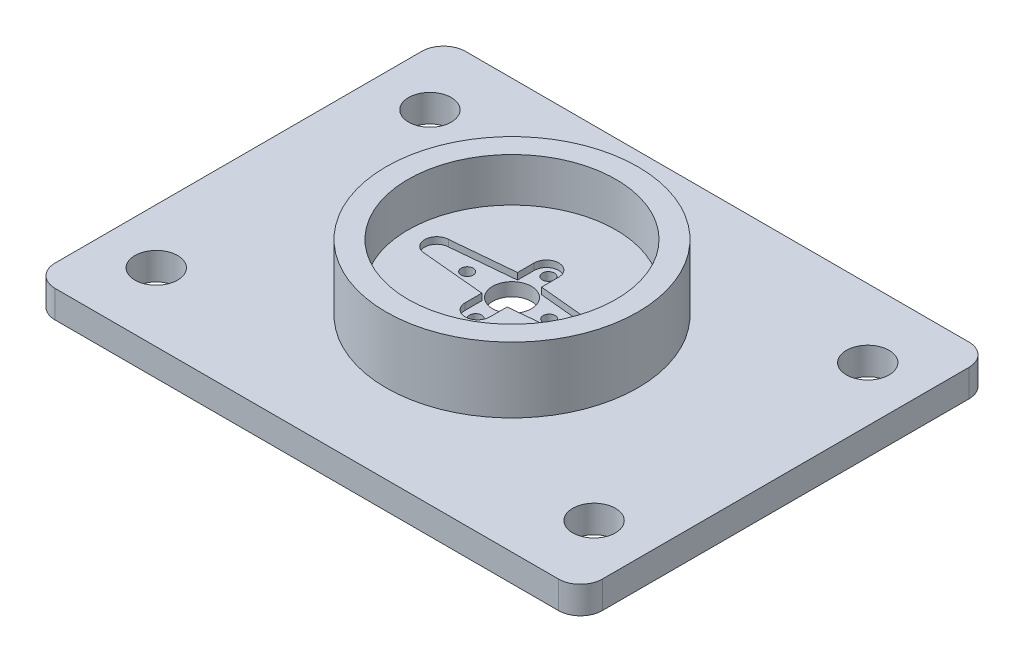
from build123d import *

# Parameters (mm, degrees)
ESQUISSE1_R             = 3.9
BOSS_EXTRU_1_DEPTH      = 5
ESQUISSE2_R             = 23
ESQUISSE2_R_2           = 19
BOSS_EXTRU_2_DEPTH      = 12
ESQUISSE5_R             = 19
BOSS_EXTRU_3_DEPTH      = 4
ENL_V_MAT_EXTRU_4_DEPTH = 1.2
ESQUISSE9_R             = 3.55
ENL_V_MAT_EXTRU_5_DEPTH = 64.173491276
ESQUISSE6_R             = 19
ENL_V_MAT_EXTRU_3_DEPTH = 5.4
ESQUISSE10_R            = 1.1
ESQUISSE10_R_2          = 0.5
ENL_V_MAT_EXTRU_6_DEPTH = 64.173491276


with BuildPart() as part:
    # Esquisse1 → Boss.-Extru.1 (new body)
    with BuildSketch(Plane(origin=(0, 0, 0), x_dir=(1, 0, 0), z_dir=(0, 1, 0))):
        with BuildLine():
            Line((46, 37.5), (-46, 37.5))
            ThreePointArc((-46, 37.5), (-48.828427125, 36.328427125), (-50, 33.5))
            Line((-50, 33.5), (-50, -33.5))
            ThreePointArc((-50, -33.5), (-48.828427125, -36.328427125), (-46, -37.5))
            Line((-46, -37.5), (46, -37.5))
            ThreePointArc((46, -37.5), (48.828427125, -36.328427125), (50, -33.5))
            Line((50, -33.5), (50, 33.5))
            ThreePointArc((50, 33.5), (48.828427125, 36.328427125), (46, 37.5))
        make_face()
        with Locations(Location((-40, -25, 0), (0, 0, 270))):
            Circle(ESQUISSE1_R, mode=Mode.SUBTRACT)
        with Locations(Location((40, -25, 0), (0, 0, 270))):
            Circle(ESQUISSE1_R, mode=Mode.SUBTRACT)
        with Locations(Location((-40, 25, 0), (0, 0, 270))):
            Circle(ESQUISSE1_R, mode=Mode.SUBTRACT)
        with Locations(Location((40, 25, 0), (0, 0, 270))):
            Circle(ESQUISSE1_R, mode=Mode.SUBTRACT)
    extrude(amount=BOSS_EXTRU_1_DEPTH)

    # Esquisse2 → Boss.-Extru.2 (add)
    with BuildSketch(Plane(origin=(0, 5, 0), x_dir=(1, 0, 0), z_dir=(0, 1, 0))):
        with Locations(Location((0, 0, 0), (0, 0, 270))):
            Circle(ESQUISSE2_R)
        with Locations(Location((0, 0, 0), (0, 0, 270))):
            Circle(ESQUISSE2_R_2, mode=Mode.SUBTRACT)
    extrude(amount=BOSS_EXTRU_2_DEPTH)

    # Esquisse5 → Boss.-Extru.3 (add)
    with BuildSketch(Plane(origin=(0, 5, 0), x_dir=(1, 0, 0), z_dir=(0, 1, 0))):
        with Locations(Location((0, 0, 0), (0, 0, 270))):
            Circle(ESQUISSE5_R)
    extrude(amount=BOSS_EXTRU_3_DEPTH)

    # Esquisse8 → Enlèv. mat.-Extru.4 (cut)
    with BuildSketch(Plane(origin=(0, 9, 0), x_dir=(1, 0, 0), z_dir=(0, 1, 0))):
        with BuildLine():
            Line((2.25, -6.3), (2.25, -3.145492982))
            Line((2.25, -3.145492982), (16.35, -1.8))
            ThreePointArc((16.35, -1.8), (18.15, 0), (16.35, 1.8))
            Line((16.35, 1.8), (2.25, 3.145492982))
            Line((2.25, 3.145492982), (2.25, 6.3))
            ThreePointArc((2.25, 6.3), (0, 8.55), (-2.25, 6.3))
            Line((-2.25, 6.3), (-2.25, 3.264730494))
            Line((-2.25, 3.264730494), (-13.769370638, 2.199914721))
            ThreePointArc((-13.769370638, 2.199914721), (-15.95, 0), (-13.769370638, -2.199914721))
            Line((-13.769370638, -2.199914721), (-2.25, -3.264730494))
            Line((-2.25, -3.264730494), (-2.25, -6.3))
            ThreePointArc((-2.25, -6.3), (0, -8.55), (2.25, -6.3))
        make_face()
    extrude(amount=-ENL_V_MAT_EXTRU_4_DEPTH, mode=Mode.SUBTRACT)

    # Esquisse9 → Enlèv. mat.-Extru.5 (cut, through all)
    with BuildSketch(Plane(origin=(0, 7.8, 0), x_dir=(1, 0, 0), z_dir=(0, 1, 0))):
        with Locations(Location((0, 0, 0), (0, 0, 270))):
            Circle(ESQUISSE9_R)
    extrude(amount=-ENL_V_MAT_EXTRU_5_DEPTH, mode=Mode.SUBTRACT)

    # Esquisse6 → Enlèv. mat.-Extru.3 (cut)
    with BuildSketch(Plane.XZ):
        with Locations(Location((0, 0, 0), (0, 0, 90))):
            Circle(ESQUISSE6_R)
    extrude(amount=-ENL_V_MAT_EXTRU_3_DEPTH, mode=Mode.SUBTRACT)

    # Esquisse10 → Enlèv. mat.-Extru.6 (cut, through all)
    # profile 1 of 10: a face of its own
    with BuildSketch(Plane(origin=(0, 7.8, 0), x_dir=(1, 0, 0), z_dir=(0, 1, 0))):
        with Locations(Location((0, 6.65, 0), (0, 0, 270))):
            Circle(ESQUISSE10_R)
        with Locations((0, 6.65)):
            Circle(ESQUISSE10_R_2, mode=Mode.SUBTRACT)
    # profile 2 of 10: a face of its own
    with BuildSketch(Plane(origin=(0, 7.8, 0), x_dir=(1, 0, 0), z_dir=(0, 1, 0))):
        with Locations((0, 6.65)):
            Circle(ESQUISSE10_R_2)
    # profile 3 of 10: a face of its own
    with BuildSketch(Plane(origin=(0, 7.8, 0), x_dir=(1, 0, 0), z_dir=(0, 1, 0))):
        with Locations(Location((0, -6.65, 0), (0, 0, 270))):
            Circle(ESQUISSE10_R)
        with Locations((0, -6.65)):
            Circle(ESQUISSE10_R_2, mode=Mode.SUBTRACT)
    # profile 4 of 10: a face of its own
    with BuildSketch(Plane(origin=(0, 7.8, 0), x_dir=(1, 0, 0), z_dir=(0, 1, 0))):
        with Locations((0, -6.65)):
            Circle(ESQUISSE10_R_2)
    # profile 5 of 10: a face of its own
    with BuildSketch(Plane(origin=(0, 7.8, 0), x_dir=(1, 0, 0), z_dir=(0, 1, 0))):
        with Locations(Location((-8.19, 0, 0), (0, 0, 270))):
            Circle(ESQUISSE10_R)
        with Locations((-8.19, 0)):
            Circle(ESQUISSE10_R_2, mode=Mode.SUBTRACT)
    # profile 6 of 10: a face of its own
    with BuildSketch(Plane(origin=(0, 7.8, 0), x_dir=(1, 0, 0), z_dir=(0, 1, 0))):
        with Locations((-8.19, 0)):
            Circle(ESQUISSE10_R_2)
    # profile 7 of 10: a face of its own
    with BuildSketch(Plane(origin=(0, 7.8, 0), x_dir=(1, 0, 0), z_dir=(0, 1, 0))):
        with Locations(Location((6.8, 0, 0), (0, 0, 270))):
            Circle(ESQUISSE10_R)
        with Locations((6.8, 0)):
            Circle(ESQUISSE10_R_2, mode=Mode.SUBTRACT)
    # profile 8 of 10: a face of its own
    with BuildSketch(Plane(origin=(0, 7.8, 0), x_dir=(1, 0, 0), z_dir=(0, 1, 0))):
        with Locations((6.8, 0)):
            Circle(ESQUISSE10_R_2)
    # profile 9 of 10: a face of its own
    with BuildSketch(Plane(origin=(0, 7.8, 0), x_dir=(1, 0, 0), z_dir=(0, 1, 0))):
        with Locations(Location((12.65, 0, 0), (0, 0, 270))):
            Circle(ESQUISSE10_R)
        with Locations((12.65, 0)):
            Circle(ESQUISSE10_R_2, mode=Mode.SUBTRACT)
    # profile 10 of 10: a face of its own
    with BuildSketch(Plane(origin=(0, 7.8, 0), x_dir=(1, 0, 0), z_dir=(0, 1, 0))):
        with Locations((12.65, 0)):
            Circle(ESQUISSE10_R_2)
    extrude(amount=-ENL_V_MAT_EXTRU_6_DEPTH, mode=Mode.SUBTRACT)


solid = part.part
